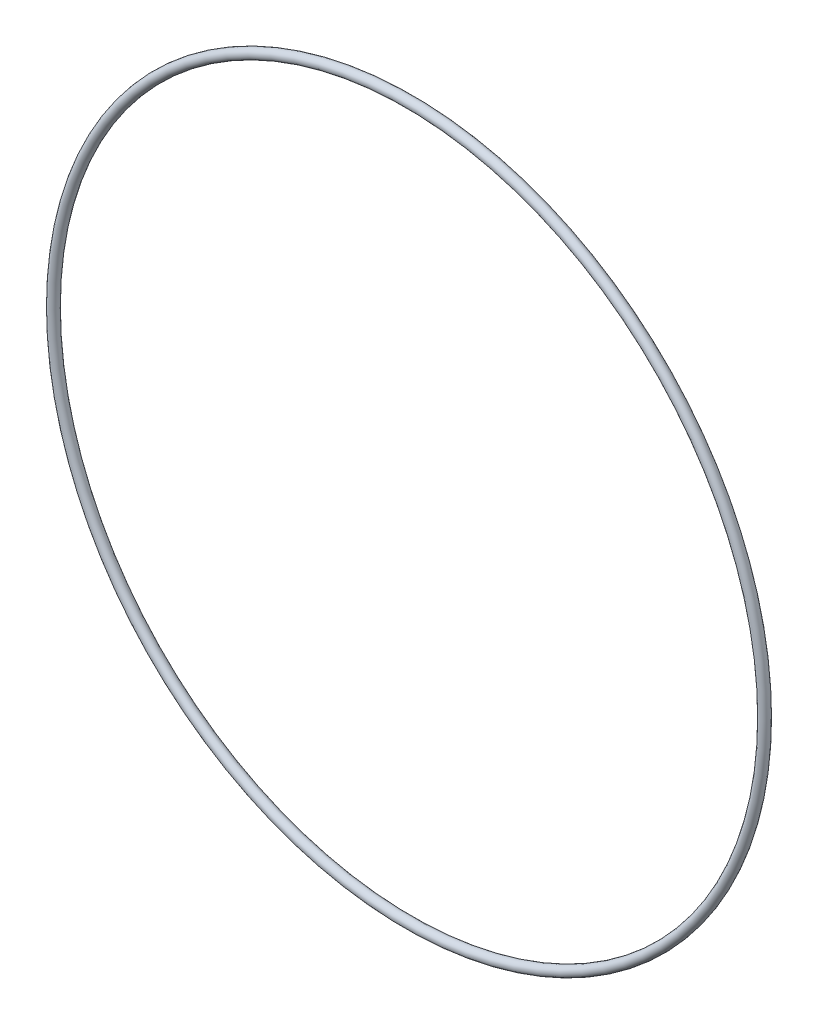
from build123d import *

# Parameters (mm, degrees)
SKETCH2_R = 0.889


with BuildPart() as part:
    # Sketch2 → Revolve1 (revolve)
    with BuildSketch(Plane(origin=(0, 0, 0), x_dir=(1, 0, 0), z_dir=(0, 1, 0)), mode=Mode.PRIVATE) as revolve1_sk:
        with Locations((-64.2493, 0)):
            Circle(SKETCH2_R)
    revolve(revolve1_sk.sketch.rotate(Axis((0, 0, 0.889), (0, 0, -1)), 180), axis=Axis((0, 0, 0.889), (0, 0, -1)))


solid = part.part
